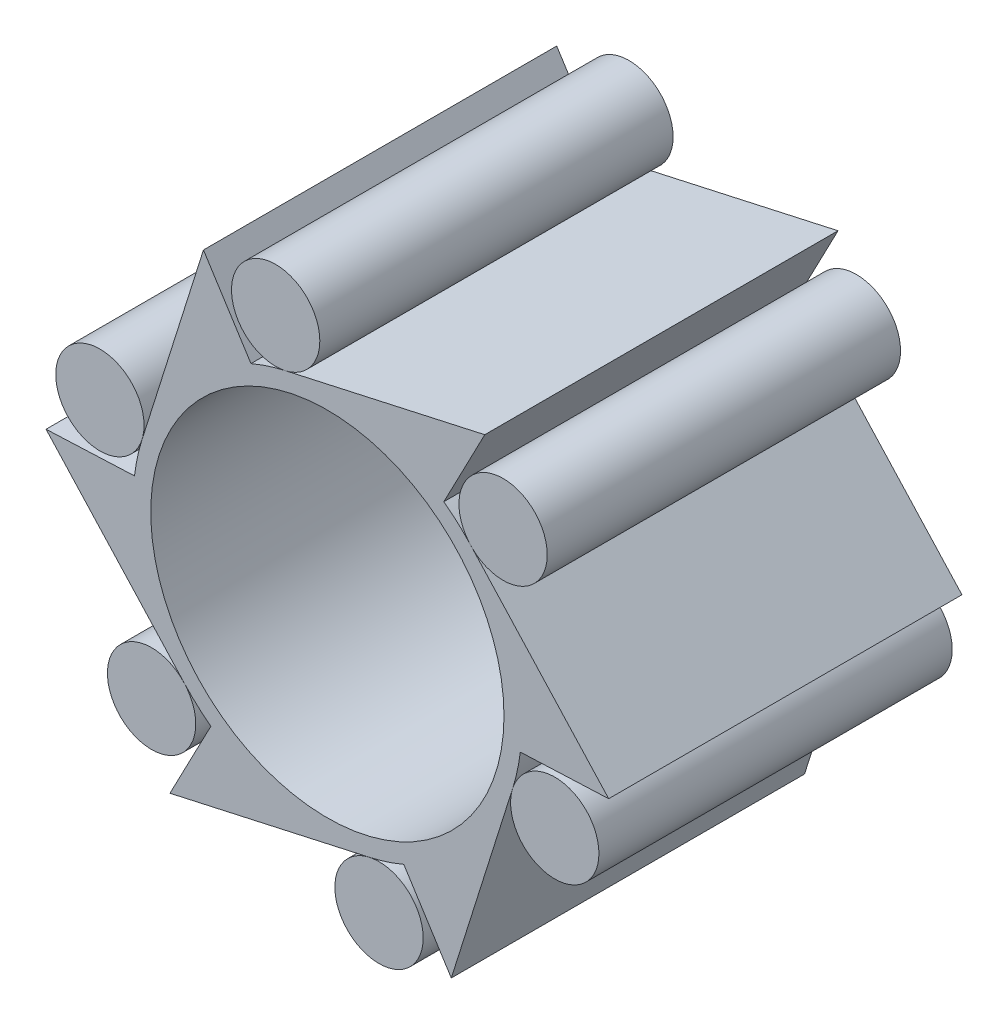
from build123d import *

# Parameters (mm, degrees)
SKETCH1_R                  = 5.5
SKETCH1_R_2                = 5
BOSS_EXTRUDE1_DEPTH        = 10
BOSS_EXTRUDE3_DEPTH        = 0.001
BOSS_EXTRUDE3_DEPTH_BACK   = 10
SKETCH4_R                  = 1.25
BOSS_EXTRUDE3_2_DEPTH      = 0.001
BOSS_EXTRUDE3_2_DEPTH_BACK = 10
BOSS_EXTRUDE3_3_DEPTH      = 0.001
BOSS_EXTRUDE3_3_DEPTH_BACK = 10
BOSS_EXTRUDE3_4_DEPTH      = 0.001
BOSS_EXTRUDE3_4_DEPTH_BACK = 10
BOSS_EXTRUDE3_5_DEPTH      = 0.001
BOSS_EXTRUDE3_5_DEPTH_BACK = 10
BOSS_EXTRUDE3_6_DEPTH      = 0.001
BOSS_EXTRUDE3_6_DEPTH_BACK = 10


with BuildPart() as part:
    # Sketch1 → Boss-Extrude1 (new body)
    # profile 1 of 7: a face of its own
    with BuildSketch(Plane.XY):
        with BuildLine():
            ThreePointArc((-4.053982993, -3.716883357), (-5.235597142, -1.684791549), (-5.460852174, 0.65505231))
            Line((-5.460852174, 0.65505231), (-7.963634689, 0.547350938))
            Line((-7.963634689, 0.547350938), (-4.053982993, -3.716883357))
        make_face()
    # profile 2 of 7: a face of its own
    with BuildSketch(Plane.XY):
        with BuildLine():
            ThreePointArc((-5.245906907, 1.65241058), (-4.076870853, 3.691764355), (-2.163134146, 5.056762864))
            Line((-2.163134146, 5.056762864), (-3.507797527, 7.170385416))
            Line((-3.507797527, 7.170385416), (-5.245906907, 1.65241058))
        make_face()
    # profile 3 of 7: a face of its own
    with BuildSketch(Plane.XY):
        with BuildLine():
            ThreePointArc((1.191923914, -5.369293937), (-1.15872629, -5.376555904), (-3.297718029, -4.401710554))
            Line((-3.297718029, -4.401710554), (-4.455837162, -6.623034478))
            Line((-4.455837162, -6.623034478), (1.191923914, -5.369293937))
        make_face()
    # profile 4 of 7: a face of its own
    with BuildSketch(Plane.XY):
        Circle(SKETCH1_R)
        Circle(SKETCH1_R_2, mode=Mode.SUBTRACT)
    # profile 5 of 7: a face of its own
    with BuildSketch(Plane.XY):
        with BuildLine():
            Line((3.507797527, -7.170385416), (5.245906907, -1.65241058))
            ThreePointArc((5.245906907, -1.65241058), (4.076870853, -3.691764355), (2.163134146, -5.056762864))
            Line((2.163134146, -5.056762864), (3.507797527, -7.170385416))
        make_face()
    # profile 6 of 7: a face of its own
    with BuildSketch(Plane.XY):
        with BuildLine():
            Line((7.963634689, -0.547350938), (4.053982993, 3.716883357))
            ThreePointArc((4.053982993, 3.716883357), (5.125763673, 1.994128072), (5.5, 0))
            ThreePointArc((5.5, 0), (5.49020432, -0.328110531), (5.460852174, -0.65505231))
            Line((5.460852174, -0.65505231), (7.963634689, -0.547350938))
        make_face()
    # profile 7 of 7: a face of its own
    with BuildSketch(Plane.XY):
        with BuildLine():
            Line((4.455837162, 6.623034478), (-1.191923914, 5.369293937))
            ThreePointArc((-1.191923914, 5.369293937), (1.15872629, 5.376555904), (3.297718029, 4.401710554))
            Line((3.297718029, 4.401710554), (4.455837162, 6.623034478))
        make_face()
    extrude(amount=BOSS_EXTRUDE1_DEPTH)


with BuildPart() as body_2:
    # Sketch4 → Boss-Extrude3 (new, two sides: drawn at the far end of the back side and taken through both)
    with BuildSketch(Plane.XY.offset(10).offset(-BOSS_EXTRUDE3_DEPTH_BACK)):
        with Locations((-1.462815712, 6.589588014)):
            Circle(SKETCH4_R)
    extrude(amount=BOSS_EXTRUDE3_DEPTH + BOSS_EXTRUDE3_DEPTH_BACK)


with BuildPart() as body_3:
    # Sketch4 → Boss-Extrude3 2 (new, two sides: drawn at the far end of the back side and taken through both)
    with BuildSketch(Plane.XY.offset(10).offset(-BOSS_EXTRUDE3_2_DEPTH_BACK)):
        with Locations((4.975342764, 4.561629575)):
            Circle(SKETCH4_R)
    extrude(amount=BOSS_EXTRUDE3_2_DEPTH + BOSS_EXTRUDE3_2_DEPTH_BACK)


with BuildPart() as body_4:
    # Sketch4 → Boss-Extrude3 3 (new, two sides: drawn at the far end of the back side and taken through both)
    with BuildSketch(Plane.XY.offset(10).offset(-BOSS_EXTRUDE3_3_DEPTH_BACK)):
        with Locations((6.438158477, -2.027958439)):
            Circle(SKETCH4_R)
    extrude(amount=BOSS_EXTRUDE3_3_DEPTH + BOSS_EXTRUDE3_3_DEPTH_BACK)


with BuildPart() as body_5:
    # Sketch4 → Boss-Extrude3 4 (new, two sides: drawn at the far end of the back side and taken through both)
    with BuildSketch(Plane.XY.offset(10).offset(-BOSS_EXTRUDE3_4_DEPTH_BACK)):
        with Locations((1.462815712, -6.589588014)):
            Circle(SKETCH4_R)
    extrude(amount=BOSS_EXTRUDE3_4_DEPTH + BOSS_EXTRUDE3_4_DEPTH_BACK)


with BuildPart() as body_6:
    # Sketch4 → Boss-Extrude3 5 (new, two sides: drawn at the far end of the back side and taken through both)
    with BuildSketch(Plane.XY.offset(10).offset(-BOSS_EXTRUDE3_5_DEPTH_BACK)):
        with Locations((-4.975342764, -4.561629575)):
            Circle(SKETCH4_R)
    extrude(amount=BOSS_EXTRUDE3_5_DEPTH + BOSS_EXTRUDE3_5_DEPTH_BACK)


with BuildPart() as body_7:
    # Sketch4 → Boss-Extrude3 6 (new, two sides: drawn at the far end of the back side and taken through both)
    with BuildSketch(Plane.XY.offset(10).offset(-BOSS_EXTRUDE3_6_DEPTH_BACK)):
        with Locations((-6.438158477, 2.027958439)):
            Circle(SKETCH4_R)
    extrude(amount=BOSS_EXTRUDE3_6_DEPTH + BOSS_EXTRUDE3_6_DEPTH_BACK)


solid = Compound([part.part, body_2.part, body_3.part, body_4.part, body_5.part, body_6.part, body_7.part])
